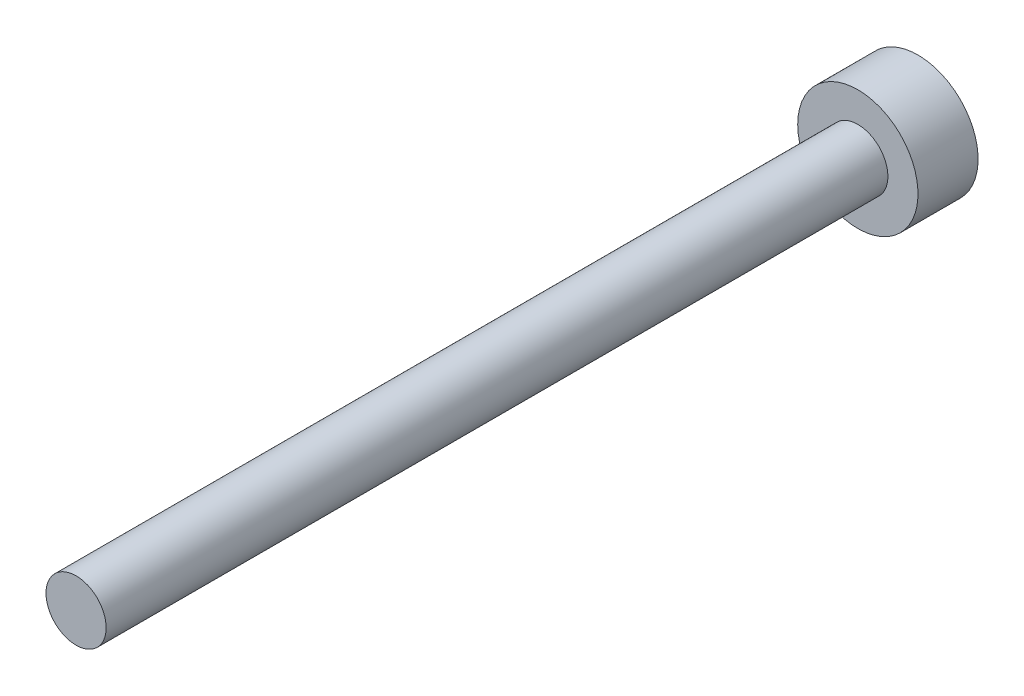
from build123d import *

# Parameters (mm, degrees)
SKETCH_1_R          = 2
EXTRUDE_1_DEPTH     = 52
SKETCH_2_R          = 4
EXTRUDE_2_DEPTH     = 4
CUT_EXTRUDE_1_DEPTH = 2


with BuildPart() as part:
    # 草图1 → 凸台-拉伸1 (new body)
    with BuildSketch(Plane.XY):
        with Locations(Location((0, 0, 0), (0, 0, 180))):
            Circle(SKETCH_1_R)
    extrude(amount=EXTRUDE_1_DEPTH)

    # 草图2 → 凸台-拉伸2 (add)
    with BuildSketch(Plane(origin=(0, 0, 0), x_dir=(-1, 0, 0), z_dir=(0, 0, -1))):
        Circle(SKETCH_2_R)
    extrude(amount=EXTRUDE_2_DEPTH)

    # 草图3 → 切除-拉伸1 (cut)
    with BuildSketch(Plane(origin=(0, 0, -4), x_dir=(-1, 0, 0), z_dir=(0, 0, -1))):
        Polygon((2, 0), (1, 1.732050808), (-1, 1.732050808), (-2, 0), (-1, -1.732050808), (1, -1.732050808), align=None)
    extrude(amount=-CUT_EXTRUDE_1_DEPTH, mode=Mode.SUBTRACT)


solid = part.part
